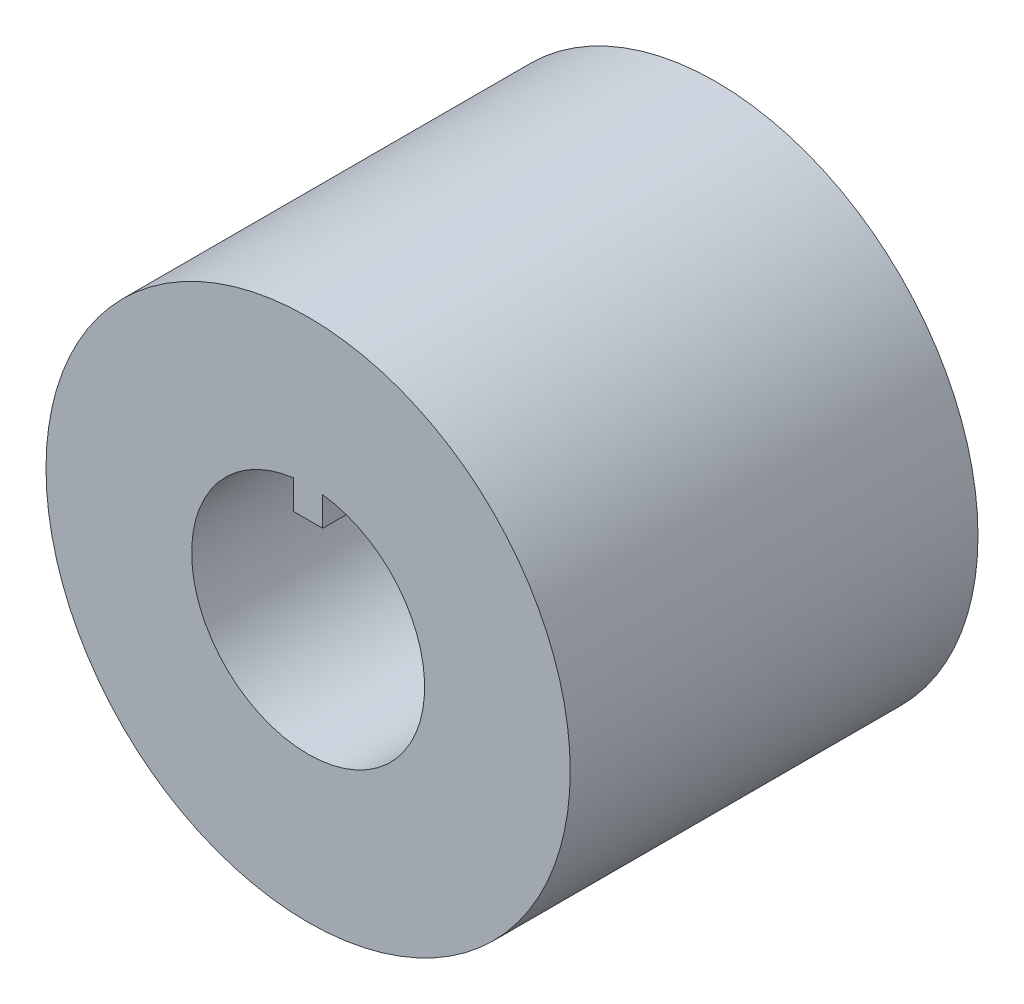
from build123d import *

# Parameters (mm, degrees)
ESQUISSE1_R        = 90
BOSS_EXTRU_1_DEPTH = 140


with BuildPart() as part:
    # Esquisse1 → Boss.-Extru.1 (new body)
    with BuildSketch(Plane.XY):
        Circle(ESQUISSE1_R)
        with BuildLine():
            Line((-5, 39.686269666), (-5, 29.686269666))
            Line((-5, 29.686269666), (5, 29.686269666))
            Line((5, 29.686269666), (4.938022826, 39.694028903))
            ThreePointArc((4.938022826, 39.694028903), (0.031230497, -39.999987808), (-5, 39.686269666))
        make_face(mode=Mode.SUBTRACT)
    extrude(amount=BOSS_EXTRU_1_DEPTH)


solid = part.part
